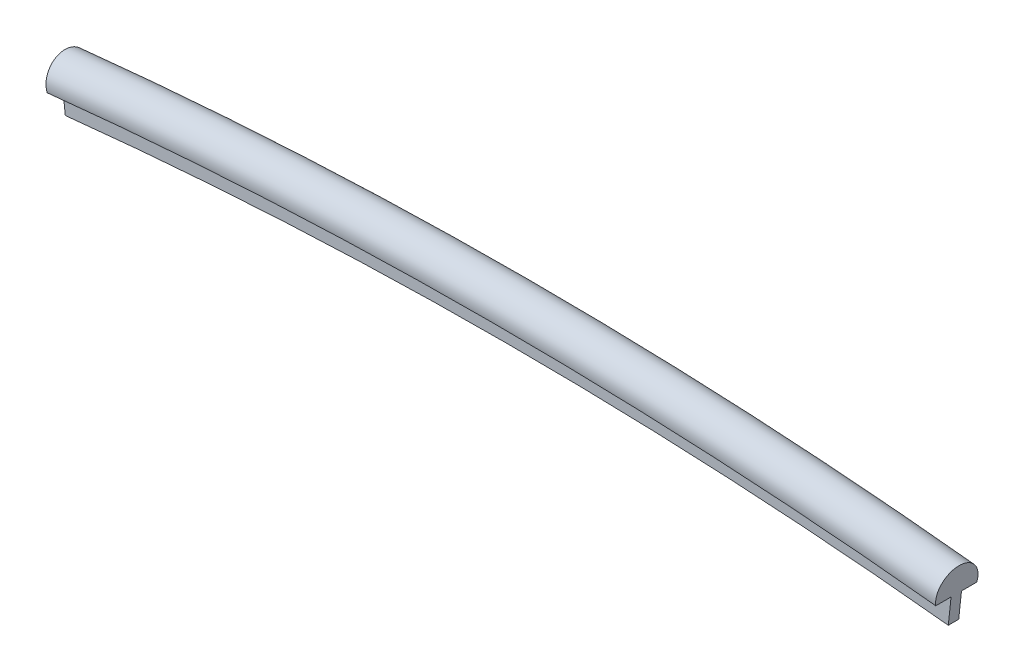
from build123d import *

# Parameters (mm, degrees)
REVOLVE1_ANGLE           = 6.083377998
REVOLVE1_OTHER_WAY_ANGLE = 6.083377998


with BuildPart() as part:
    # Sketch2 → Revolve1 (revolve)
    with BuildSketch(Plane(origin=(0, 0, 0), x_dir=(0, 0, -1), z_dir=(1, 0, 0))):
        with BuildLine():
            Line((0, 239.8), (0.3, 239.8))
            Line((0.3, 239.8), (0.3, 241.3))
            Line((0.3, 241.3), (1.18, 241.3))
            ThreePointArc((1.18, 241.3), (0, 242.800182019), (-1.18, 241.3))
            Line((-1.18, 241.3), (-0.3, 241.3))
            Line((-0.3, 241.3), (-0.3, 239.8))
            Line((-0.3, 239.8), (0, 239.8))
        make_face()
    revolve(axis=Axis((0, 0, 70.597641597), (0, 0, -1)), revolution_arc=REVOLVE1_ANGLE)

    # Sketch2 → Revolve1 other way (revolve)
    with BuildSketch(Plane(origin=(0, 0, 0), x_dir=(0, 0, -1), z_dir=(1, 0, 0))):
        with BuildLine():
            Line((0, 239.8), (0.3, 239.8))
            Line((0.3, 239.8), (0.3, 241.3))
            Line((0.3, 241.3), (1.18, 241.3))
            ThreePointArc((1.18, 241.3), (0, 242.800182019), (-1.18, 241.3))
            Line((-1.18, 241.3), (-0.3, 241.3))
            Line((-0.3, 241.3), (-0.3, 239.8))
            Line((-0.3, 239.8), (0, 239.8))
        make_face()
    revolve(axis=Axis((0, 0, 70.597641597), (0, 0, 1)), revolution_arc=REVOLVE1_OTHER_WAY_ANGLE)


solid = part.part
